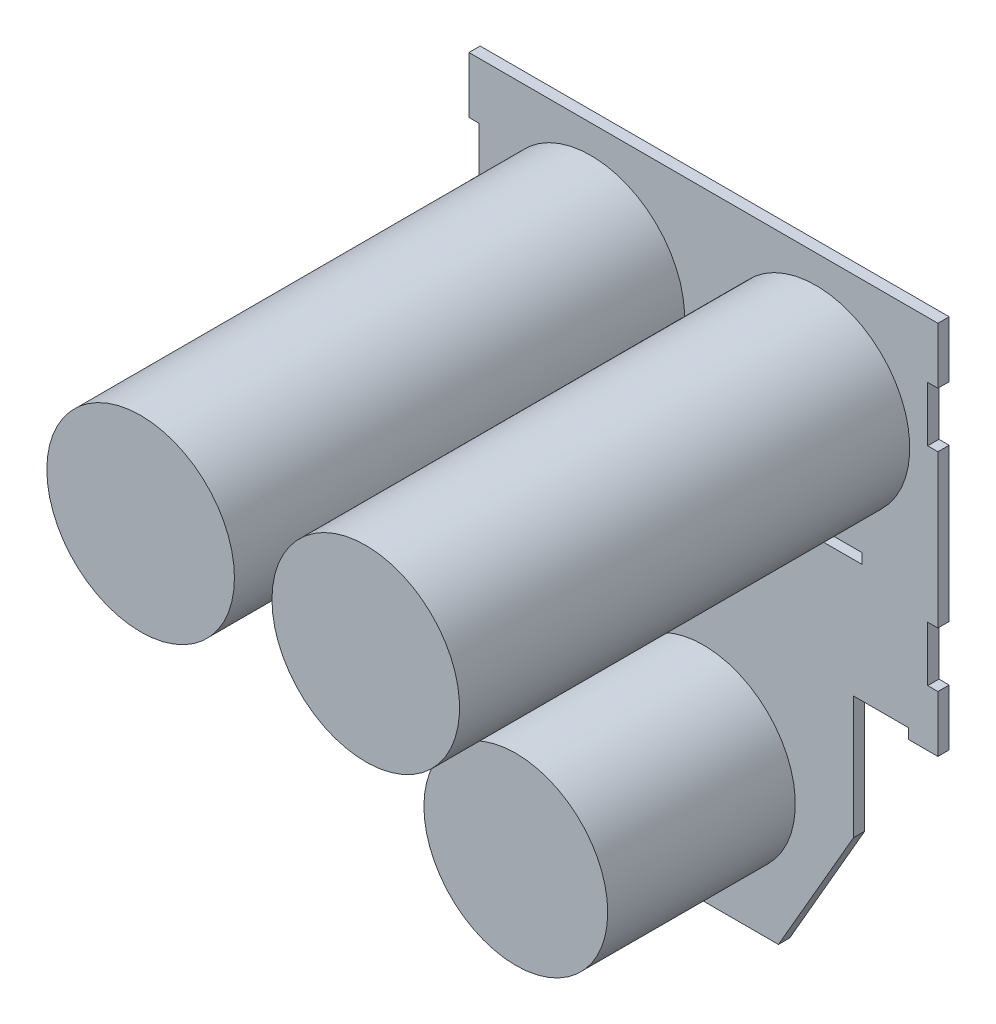
from build123d import *

# Parameters (mm, degrees)
SKETCH_1_W      = 29.3
SKETCH_1_H      = 5.45
EXTRUDE_1_DEPTH = 6
SKETCH_2_R      = 48.989794856
EXTRUDE_2_DEPTH = 100
SKETCH_3_R      = 50
EXTRUDE_3_DEPTH = 240


with BuildPart() as part:
    # Эскиз1 → Бобышка-Вытянуть1 (new body)
    with BuildSketch(Plane.XY):
        Polygon((0, 0), (-250, 0), (-250, -30), (-244.55, -30), (-244.55, -59.3), (-250, -59.3), (-250, -140.7), (-244.55, -140.7), (-244.55, -170), (-250, -170), (-250, -200), (-234.3, -200), (-234.3, -194.55), (-205, -194.55), (-205, -260), (-165, -329.282032303), (-85, -329.282032303), (-45, -260), (-45, -194.55), (-15.7, -194.55), (-15.7, -200), (0, -200), (0, -170), (-5.45, -170), (-5.45, -140.7), (0, -140.7), (0, -59.3), (-5.45, -59.3), (-5.45, -30), (0, -30), align=None)
        with Locations((-55, -128.825)):
            Rectangle(SKETCH_1_W, SKETCH_1_H, mode=Mode.SUBTRACT)
        with Locations((-195, -128.825)):
            Rectangle(SKETCH_1_W, SKETCH_1_H, mode=Mode.SUBTRACT)
        with Locations((-125, -128.825)):
            Rectangle(SKETCH_1_W, SKETCH_1_H, mode=Mode.SUBTRACT)
    extrude(amount=EXTRUDE_1_DEPTH)

    # Эскиз2 → Бобышка-Вытянуть2 (add)
    with BuildSketch(Plane.XY.offset(6)):
        with Locations(Location((-125, -260, 0), (0, 0, 180))):
            Circle(SKETCH_2_R)
    extrude(amount=EXTRUDE_2_DEPTH)

    # Эскиз3 → Бобышка-Вытянуть3 (add)
    with BuildSketch(Plane.XY.offset(6)):
        with Locations(Location((-185, -65, 0), (0, 0, 180))):
            Circle(SKETCH_3_R)
        with Locations(Location((-65, -65, 0), (0, 0, 180))):
            Circle(SKETCH_3_R)
    extrude(amount=EXTRUDE_3_DEPTH)


solid = part.part
